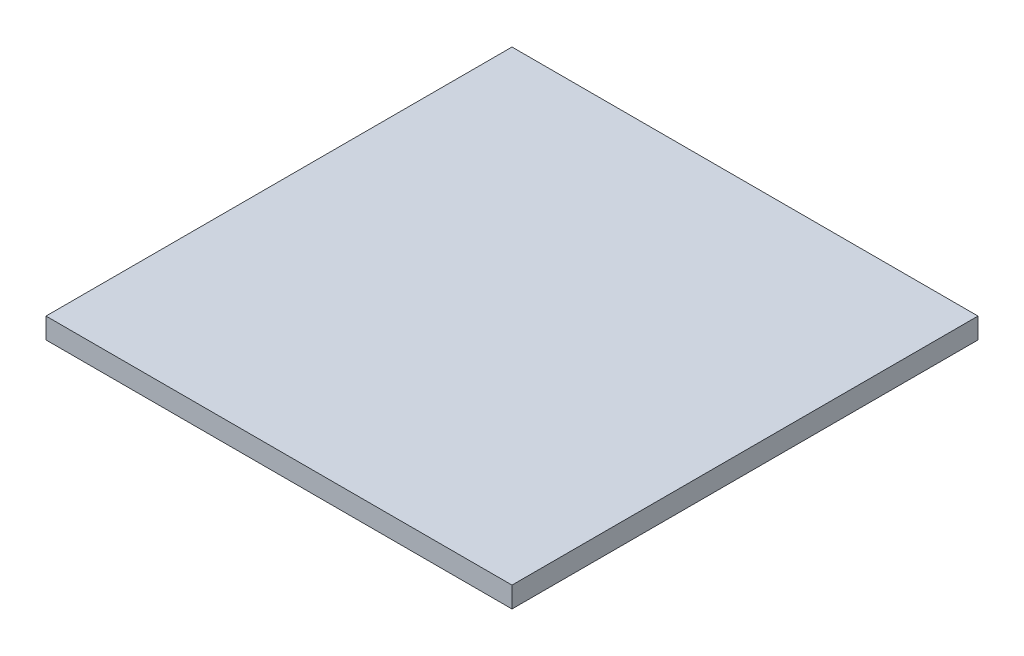
from build123d import *

# Parameters (mm, degrees)
SKETCH_1_W      = 180
SKETCH_1_H      = 180
EXTRUDE_1_DEPTH = 8


with BuildPart() as part:
    # 草图1 → 凸台-拉伸1 (new body)
    with BuildSketch(Plane(origin=(0, 0, 0), x_dir=(1, 0, 0), z_dir=(0, 1, 0))):
        with Locations((8.697478992, -40.651260504)):
            Rectangle(SKETCH_1_W, SKETCH_1_H)
    extrude(amount=EXTRUDE_1_DEPTH)


solid = part.part
